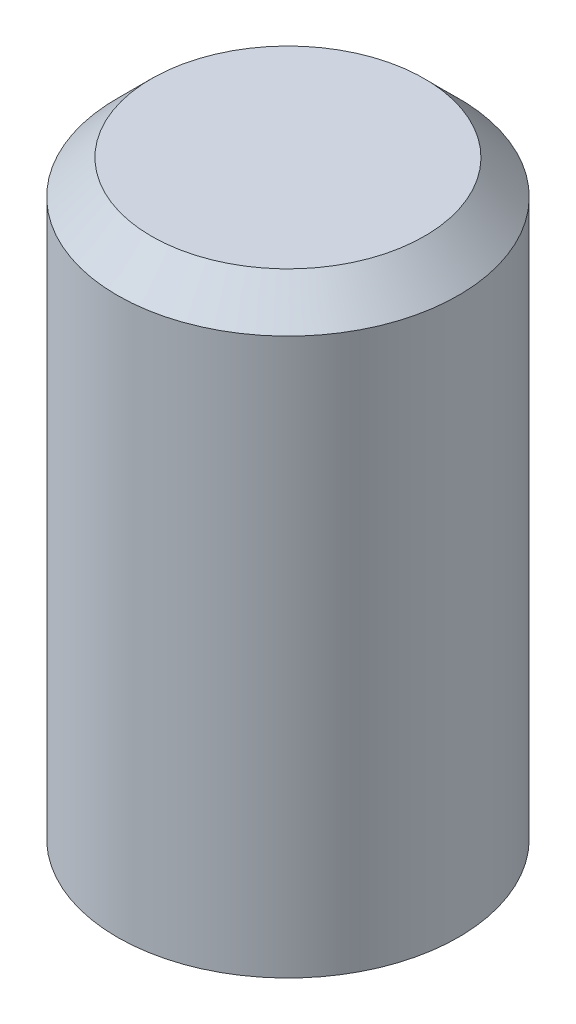
from build123d import *

# Parameters (mm, degrees)
EXTRUDE_1_DEPTH      = 300
EXTRUDE_1_DEPTH_BACK = 70
SKETCH_1_R           = 107
CHAMFER_1_SIZE       = 21.4


with BuildPart() as part:
    # Эскиз1 → Бобышка-Вытянуть1 (new, two sides: drawn at the far end of the back side and taken through both)
    with BuildSketch(Plane(origin=(0, 0, 0), x_dir=(1, 0, 0), z_dir=(0, 1, 0)).offset(-EXTRUDE_1_DEPTH_BACK)):
        with Locations(Location((0, 0, 0), (0, 0, 270))):
            Circle(SKETCH_1_R)
    extrude(amount=EXTRUDE_1_DEPTH + EXTRUDE_1_DEPTH_BACK)

    # Фаска1
    chamfer_1_edges = [part.edges().sort_by_distance(p)[0] for p in [
        (0, 300, -107),
    ]]
    chamfer(chamfer_1_edges, length=CHAMFER_1_SIZE)


solid = part.part
